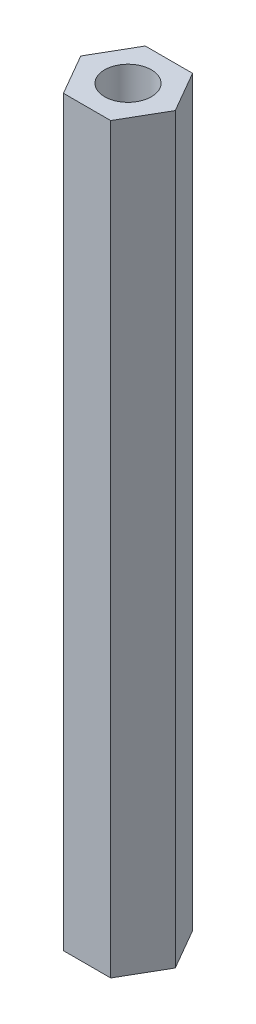
from build123d import *

# Parameters (mm, degrees)
SKETCH1_R           = 2
BOSS_EXTRUDE1_DEPTH = 63.5


with BuildPart() as part:
    # Sketch1 → Boss-Extrude1 (new body)
    with BuildSketch(Plane(origin=(0, 0, 0), x_dir=(1, 0, 0), z_dir=(0, 1, 0))):
        Polygon((-2.020725942, 3.5), (-4.041451884, 0), (-2.020725942, -3.5), (2.020725942, -3.5), (4.041451884, 0), (2.020725942, 3.5), align=None)
        with Locations(Location((0, 0, 0), (0, 0, 270))):
            Circle(SKETCH1_R, mode=Mode.SUBTRACT)
    extrude(amount=BOSS_EXTRUDE1_DEPTH)


solid = part.part
